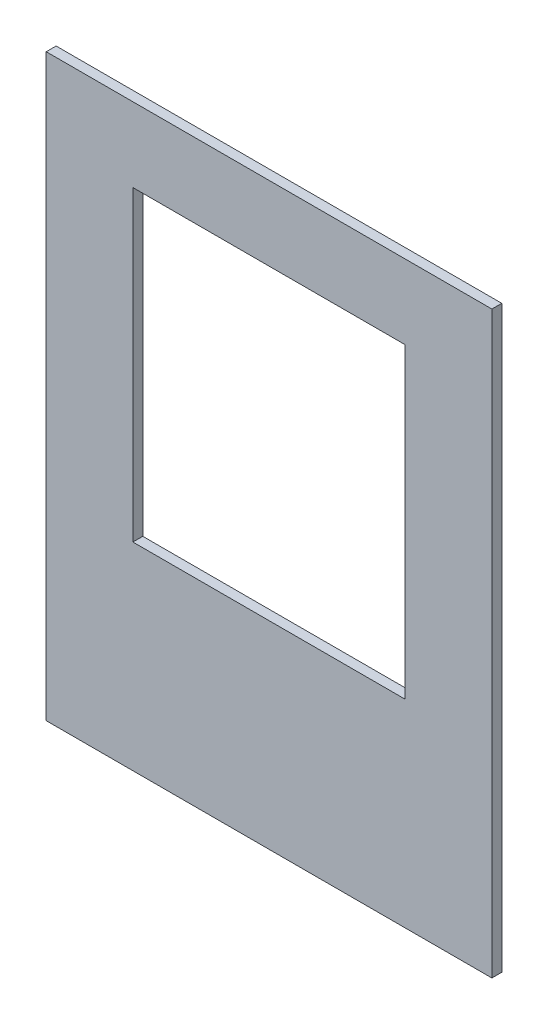
from build123d import *

# Parameters (mm, degrees)
SKETCH1_W           = 360
SKETCH1_H           = 90
SKETCH1_H_2         = 378
SKETCH1_W_2         = 220
SKETCH1_H_3         = 248
BOSS_EXTRUDE1_DEPTH = 8


with BuildPart() as part:
    # Sketch1 → Boss-Extrude1 (new body)
    # profile 1 of 2: a face of its own
    with BuildSketch(Plane.XY):
        with Locations((0, -239)):
            Rectangle(SKETCH1_W, SKETCH1_H)
    # profile 2 of 2: a face of its own
    with BuildSketch(Plane.XY):
        with Locations((0, -5)):
            Rectangle(SKETCH1_W, SKETCH1_H_2)
        Rectangle(SKETCH1_W_2, SKETCH1_H_3, mode=Mode.SUBTRACT)
    extrude(amount=BOSS_EXTRUDE1_DEPTH)


solid = part.part
